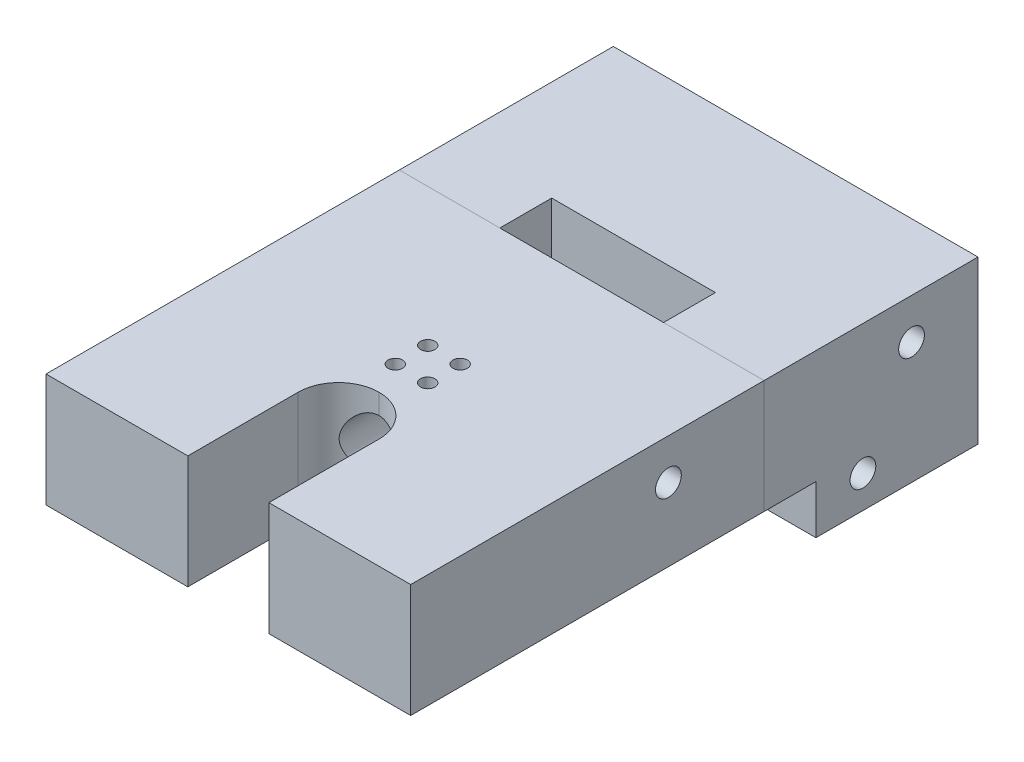
from build123d import *

# Parameters (mm, degrees)
BASE_DEPTH              = 12.7
BASE_DEPTH_BACK         = 12.7
SKETCH1_W               = 57.15
SKETCH1_H               = 88.9
SKETCH2_R               = 4.7625
SHAFTGUIDE_DEPTH        = 25.4
ACTUATORPLANECUT_DEPTH  = 7.62
WIRECHANNEL_DEPTH       = 55.34724579
WIRECHANNEL_DEPTH_BACK  = 55.34724579
SKETCH5_W               = 25.654
SKETCH5_H               = 8.128
SKETCH13_W              = 15.748
SKETCH13_H              = 8.128
WIRECHANNELBOTTOM_DEPTH = 7.62
SKETCH15_R              = 2.0193
FRONTBOLTHOLES_DEPTH    = 57.15
SKETCH17_R              = 4.2164
FRONTCOUNTERBORES_DEPTH = 5.461
GEARBOXPIT_DEPTH        = 11.176
GEARBOXSLOTS_DEPTH      = 13.716
TOGGLEASSEMHOLES_D      = 2.7051
TOGGLEASSEMHOLES_DEPTH  = 9.398
TOGGLEASSEMHOLES_TIP    = 0.81269403
PITCHASSEMHOLES_D       = 4.0386
PITCHASSEMHOLES_DEPTH   = 14.1224
PITCHASSEMHOLES_TIP     = 1.213317848
GRIPSLOT_DEPTH          = 18.288
LINACTHOLE_REACH        = 96.239
SKETCH51_R              = 4.445
LINACTSETHOLES_REACH    = 60.63
LINACTSETHOLES_BORE_R   = 1.1303


with BuildPart() as part:
    # Sketch1 → Base (new, two sides: drawn at the far end of the back side and taken through both)
    with BuildSketch(Plane(origin=(0, 0, 0), x_dir=(1, 0, 0), z_dir=(0, 1, 0)).offset(-BASE_DEPTH_BACK)):
        Rectangle(SKETCH1_W, SKETCH1_H)
    extrude(amount=BASE_DEPTH + BASE_DEPTH_BACK)

    # Sketch2 → ShaftGuide (cut)
    with BuildSketch(Plane(origin=(0, 0, -44.45), x_dir=(-1, 0, 0), z_dir=(0, 0, -1))):
        with Locations((0, -12.7)):
            Circle(SKETCH2_R)
    extrude(amount=-SHAFTGUIDE_DEPTH, mode=Mode.SUBTRACT)

    # Sketch3 → ActuatorPlaneCut (cut)
    with BuildSketch(Plane(origin=(0, -12.7, 0), x_dir=(-1, 0, 0), z_dir=(0, -1, 0))):
        Polygon((10.922, -20.828), (16.002, -20.828), (16.002, 10.922), (28.575, 10.922), (28.575, -3.175), (28.575, -44.45), (-28.575, -44.45), (-28.575, -3.175), (-28.575, 10.922), (-16.002, 10.922), (-16.002, -20.828), (-10.922, -20.828), (-10.922, 10.922), (10.922, 10.922), align=None)
    extrude(amount=-ACTUATORPLANECUT_DEPTH, mode=Mode.SUBTRACT)

    # Sketch5 → WireChannel (cut, two sides: drawn at the far end of the back side and taken through both)
    with BuildSketch(Plane(origin=(0, 0, 0), x_dir=(1, 0, 0), z_dir=(0, 1, 0)).offset(-WIRECHANNEL_DEPTH_BACK)):
        with Locations((0, 14.986)):
            Rectangle(SKETCH5_W, SKETCH5_H)
    extrude(amount=WIRECHANNEL_DEPTH + WIRECHANNEL_DEPTH_BACK, mode=Mode.SUBTRACT)

    # Sketch13 → WireChannelBottom (cut)
    with BuildSketch(Plane.XZ.offset(12.7)):
        with Locations((20.701, -14.986)):
            Rectangle(SKETCH13_W, SKETCH13_H)
    extrude(amount=-WIRECHANNELBOTTOM_DEPTH, mode=Mode.SUBTRACT)

    # Sketch15 → FrontBoltHoles (cut)
    with BuildSketch(Plane(origin=(0, 0, -44.45), x_dir=(-1, 0, 0), z_dir=(0, 0, -1))):
        with Locations((-14.605, 0)):
            Circle(SKETCH15_R)
        with Locations((14.605, 0)):
            Circle(SKETCH15_R)
    extrude(amount=-FRONTBOLTHOLES_DEPTH, mode=Mode.SUBTRACT)

    # Sketch17 → FrontCounterBores (cut)
    with BuildSketch(Plane(origin=(0, 0, -44.45), x_dir=(-1, 0, 0), z_dir=(0, 0, -1))):
        with Locations((-14.605, 0)):
            Circle(SKETCH17_R)
        with Locations((14.605, 0)):
            Circle(SKETCH17_R)
    extrude(amount=-FRONTCOUNTERBORES_DEPTH, mode=Mode.SUBTRACT)

    # Sketch40 → GearBoxPit (cut)
    with BuildSketch(Plane.XZ.offset(12.7)):
        with BuildLine():
            Line((10.922, -10.922), (-10.922, -10.922))
            Line((-10.922, -10.922), (-10.922, 17.653))
            ThreePointArc((-10.922, 17.653), (-9.99206403, 19.89806403), (-7.747, 20.828))
            Line((-7.747, 20.828), (7.747, 20.828))
            ThreePointArc((7.747, 20.828), (9.99206403, 19.89806403), (10.922, 17.653))
            Line((10.922, 17.653), (10.922, -10.922))
        make_face()
    extrude(amount=-GEARBOXPIT_DEPTH, mode=Mode.SUBTRACT)

    # Sketch22 → GearBoxSlots (cut)
    with BuildSketch(Plane.XZ.offset(12.7)):
        with BuildLine():
            Line((2.413, 19.58975), (-2.413, 19.58975))
            ThreePointArc((-2.413, 19.58975), (-2.809875, 19.192875), (-2.413, 18.796))
            Line((-2.413, 18.796), (2.413, 18.796))
            ThreePointArc((2.413, 18.796), (2.809875, 19.192875), (2.413, 19.58975))
        make_face()
        with BuildLine():
            Line((2.413, 8.128), (-2.413, 8.128))
            ThreePointArc((-2.413, 8.128), (-2.809875, 8.524875), (-2.413, 8.92175))
            Line((-2.413, 8.92175), (2.413, 8.92175))
            ThreePointArc((2.413, 8.92175), (2.809875, 8.524875), (2.413, 8.128))
        make_face()
    extrude(amount=-GEARBOXSLOTS_DEPTH, mode=Mode.SUBTRACT)

    # ToggleAssemHoles
    with Locations(Plane(origin=(0, -12.7, 0), x_dir=(-1, 0, 0), z_dir=(0, -1, 0))):
        with Locations((12.7, 28.575), (-12.7, 28.575)):
            Hole(TOGGLEASSEMHOLES_D / 2, depth=TOGGLEASSEMHOLES_DEPTH)
            with Locations((0, 0, -(TOGGLEASSEMHOLES_DEPTH + TOGGLEASSEMHOLES_TIP / 2))):  # 118° drill point
                Cone(0, TOGGLEASSEMHOLES_D / 2, TOGGLEASSEMHOLES_TIP, mode=Mode.SUBTRACT)

    # PitchAssemHoles
    with Locations(Plane(origin=(28.575, 0, 0), x_dir=(0, 0, -1), z_dir=(1, 0, 0))):
        with Locations((34.036, 6.35), (26.416, -7.62), (-4.064, 6.35)):
            Hole(PITCHASSEMHOLES_D / 2, depth=PITCHASSEMHOLES_DEPTH)
            with Locations((0, 0, -(PITCHASSEMHOLES_DEPTH + PITCHASSEMHOLES_TIP / 2))):  # 118° drill point
                Cone(0, PITCHASSEMHOLES_D / 2, PITCHASSEMHOLES_TIP, mode=Mode.SUBTRACT)

    # Sketch39 → GripSlot (cut)
    with BuildSketch(Plane(origin=(0, 12.7, 0), x_dir=(1, 0, 0), z_dir=(0, 1, 0))):
        with BuildLine():
            Line((-6.35, -97.028), (6.35, -97.028))
            Line((6.35, -97.028), (6.35, -27.17546))
            ThreePointArc((6.35, -27.17546), (4.490872009, -22.687127991), (0.00254, -20.828))
            Line((0.00254, -20.828), (-0.00254, -20.828))
            ThreePointArc((-0.00254, -20.828), (-4.490872009, -22.687127991), (-6.35, -27.17546))
            Line((-6.35, -27.17546), (-6.35, -97.028))
        make_face()
    extrude(amount=-GRIPSLOT_DEPTH, mode=Mode.SUBTRACT)

    # LinActHole: up to this face of the body (flat: up to its plane)
    linacthole_end = Plane(part.part.faces().sort_by_distance((0, -0.254, 8.128))[0])
    # Sketch51 → LinActHole (cut, up to the picked face)
    with BuildSketch(Plane(origin=(0, 0, 44.45), x_dir=(-1, 0, 0), z_dir=(0, 0, -1)), mode=Mode.PRIVATE) as linacthole_sk1:
        with Locations(Location((0, 5.08, 0), (0, 0, 246.104491814))):
            Circle(SKETCH51_R)
    linacthole_tool1 = split(extrude(linacthole_sk1.sketch, amount=LINACTHOLE_REACH, mode=Mode.PRIVATE), bisect_by=linacthole_end, keep=Keep.BOTH, mode=Mode.PRIVATE)
    add(linacthole_tool1.solids().sort_by(Axis((0, 5.08, 44.45), (0, 0, -1)))[0], mode=Mode.SUBTRACT)

    # LinActSetHoles bore → LinActSetHoles (cut, up to next)
    with BuildSketch(Plane(origin=(0, 12.7, 0), x_dir=(1, 0, 0), z_dir=(0, 1, 0)), mode=Mode.PRIVATE) as linactsetholes_sk1:
        with Locations((2.54, -15.748)):
            Circle(LINACTSETHOLES_BORE_R)
    linactsetholes_tool1 = extrude(linactsetholes_sk1.sketch, amount=-LINACTSETHOLES_REACH, mode=Mode.PRIVATE) & part.part
    # LinActSetHoles bore → LinActSetHoles (cut, up to next)
    with BuildSketch(Plane(origin=(0, 12.7, 0), x_dir=(1, 0, 0), z_dir=(0, 1, 0)), mode=Mode.PRIVATE) as linactsetholes_sk2:
        with Locations((-2.54, -15.748)):
            Circle(LINACTSETHOLES_BORE_R)
    linactsetholes_tool2 = extrude(linactsetholes_sk2.sketch, amount=-LINACTSETHOLES_REACH, mode=Mode.PRIVATE) & part.part
    # LinActSetHoles bore → LinActSetHoles (cut, up to next)
    with BuildSketch(Plane(origin=(0, 12.7, 0), x_dir=(1, 0, 0), z_dir=(0, 1, 0)), mode=Mode.PRIVATE) as linactsetholes_sk3:
        with Locations((2.54, -10.668)):
            Circle(LINACTSETHOLES_BORE_R)
    linactsetholes_tool3 = extrude(linactsetholes_sk3.sketch, amount=-LINACTSETHOLES_REACH, mode=Mode.PRIVATE) & part.part
    # LinActSetHoles bore → LinActSetHoles (cut, up to next)
    with BuildSketch(Plane(origin=(0, 12.7, 0), x_dir=(1, 0, 0), z_dir=(0, 1, 0)), mode=Mode.PRIVATE) as linactsetholes_sk4:
        with Locations((-2.54, -10.668)):
            Circle(LINACTSETHOLES_BORE_R)
    linactsetholes_tool4 = extrude(linactsetholes_sk4.sketch, amount=-LINACTSETHOLES_REACH, mode=Mode.PRIVATE) & part.part
    add(linactsetholes_tool1.solids().sort_by_distance((2.54, 12.7, 15.748))[0], mode=Mode.SUBTRACT)
    add(linactsetholes_tool2.solids().sort_by_distance((-2.54, 12.7, 15.748))[0], mode=Mode.SUBTRACT)
    add(linactsetholes_tool3.solids().sort_by_distance((2.54, 12.7, 10.668))[0], mode=Mode.SUBTRACT)
    add(linactsetholes_tool4.solids().sort_by_distance((-2.54, 12.7, 10.668))[0], mode=Mode.SUBTRACT)


with BuildPart() as body_2:
    # Split1: the piece on the far side of the plane
    add(part.part)
    split(bisect_by=Plane(origin=(0, 0, -10.922), x_dir=(-1, 0, 0), z_dir=(0, 0, -1)), keep=Keep.BOTTOM)


with BuildPart() as part_1:
    add(part.part)

    # Split1
    split(bisect_by=Plane(origin=(0, 0, -10.922), x_dir=(-1, 0, 0), z_dir=(0, 0, -1)), keep=Keep.TOP)


solid = Compound([body_2.part, part_1.part])
